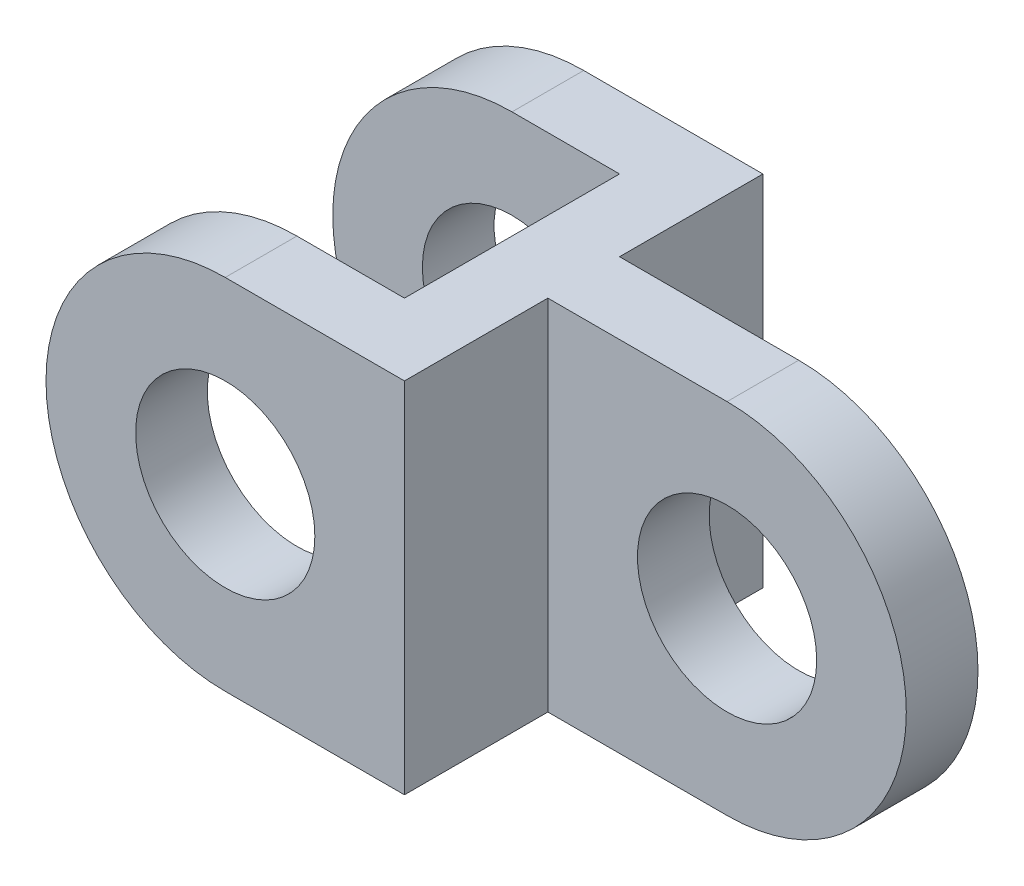
from build123d import *

# Parameters (mm, degrees)
SALIENTE_EXTRUIR1_DEPTH = 100
REDONDEO1_RADIUS        = 50
REDONDEO1_LENGTH        = 20
REDONDEO2_RADIUS        = 50
REDONDEO2_LENGTH        = 20
CROQUIS3_R              = 25
CORTAR_EXTRUIR1_DEPTH   = 174.205080757
CROQUIS10_W             = 20
CROQUIS10_H             = 100
SALIENTE_EXTRUIR3_DEPTH = 100
REDONDEO3_RADIUS        = 50
REDONDEO3_LENGTH        = 20
CROQUIS11_R             = 25
CORTAR_EXTRUIR5_DEPTH   = 154.622914957


with BuildPart() as part:
    # Croquis1 → Saliente-Extruir1 (new body)
    with BuildSketch(Plane(origin=(0, 0, 0), x_dir=(1, 0, 0), z_dir=(0, 1, 0))):
        Polygon((-100, 100), (0, 100), (0, 0), (-100, 0), (-100, 20), (-20, 20), (-20, 80), (-100, 80), align=None)
    extrude(amount=SALIENTE_EXTRUIR1_DEPTH)

    # Redondeo1: full round fillet: the end face becomes a half cylinder, R = half its width
    redondeo1_face = Plane((-100, 50, -90), x_dir=(0, 0, 1), z_dir=(-1, 0, 0))  # on the end face: x along it, z out of the body
    redondeo1_slab = redondeo1_face.offset(-REDONDEO1_RADIUS / 2) * Box(REDONDEO1_LENGTH, 2 * REDONDEO1_RADIUS, REDONDEO1_RADIUS, mode=Mode.PRIVATE)  # the body's end, R deep
    redondeo1_round = Plane((-50, 50, -90), x_dir=(-1, 0, 0), z_dir=(0, 0, 1)) * Cylinder(REDONDEO1_RADIUS, REDONDEO1_LENGTH, mode=Mode.PRIVATE)  # its axis R under the face
    add(redondeo1_slab - redondeo1_round, mode=Mode.SUBTRACT)

    # Redondeo2: full round fillet: the end face becomes a half cylinder, R = half its width
    redondeo2_face = Plane((-100, 50, -10), x_dir=(0, 0, -1), z_dir=(-1, 0, 0))  # on the end face: x along it, z out of the body
    redondeo2_slab = redondeo2_face.offset(-REDONDEO2_RADIUS / 2) * Box(REDONDEO2_LENGTH, 2 * REDONDEO2_RADIUS, REDONDEO2_RADIUS, mode=Mode.PRIVATE)  # the body's end, R deep
    redondeo2_round = Plane((-50, 50, -10), x_dir=(-1, 0, 0), z_dir=(0, 0, -1)) * Cylinder(REDONDEO2_RADIUS, REDONDEO2_LENGTH, mode=Mode.PRIVATE)  # its axis R under the face
    add(redondeo2_slab - redondeo2_round, mode=Mode.SUBTRACT)

    # Croquis3 → Cortar-Extruir1 (cut, through all)
    with BuildSketch(Plane.XY):
        with Locations((-50, 50)):
            Circle(CROQUIS3_R)
    extrude(amount=-CORTAR_EXTRUIR1_DEPTH, mode=Mode.SUBTRACT)

    # Croquis10 → Saliente-Extruir3 (add)
    with BuildSketch(Plane(origin=(0, 0, 0), x_dir=(0, 0, -1), z_dir=(1, 0, 0))):
        with Locations((50, 50)):
            Rectangle(CROQUIS10_W, CROQUIS10_H)
    extrude(amount=SALIENTE_EXTRUIR3_DEPTH)

    # Redondeo3: full round fillet: the end face becomes a half cylinder, R = half its width
    redondeo3_face = Plane((100, 50, -50), x_dir=(0, 0, 1), z_dir=(1, 0, 0))  # on the end face: x along it, z out of the body
    redondeo3_slab = redondeo3_face.offset(-REDONDEO3_RADIUS / 2) * Box(REDONDEO3_LENGTH, 2 * REDONDEO3_RADIUS, REDONDEO3_RADIUS, mode=Mode.PRIVATE)  # the body's end, R deep
    redondeo3_round = Plane((50, 50, -50), x_dir=(1, 0, 0), z_dir=(0, 0, 1)) * Cylinder(REDONDEO3_RADIUS, REDONDEO3_LENGTH, mode=Mode.PRIVATE)  # its axis R under the face
    add(redondeo3_slab - redondeo3_round, mode=Mode.SUBTRACT)

    # Croquis11 → Cortar-Extruir5 (cut, through all)
    with BuildSketch(Plane.XY.offset(-40)):
        with Locations((50, 50)):
            Circle(CROQUIS11_R)
    extrude(amount=-CORTAR_EXTRUIR5_DEPTH, mode=Mode.SUBTRACT)


solid = part.part
